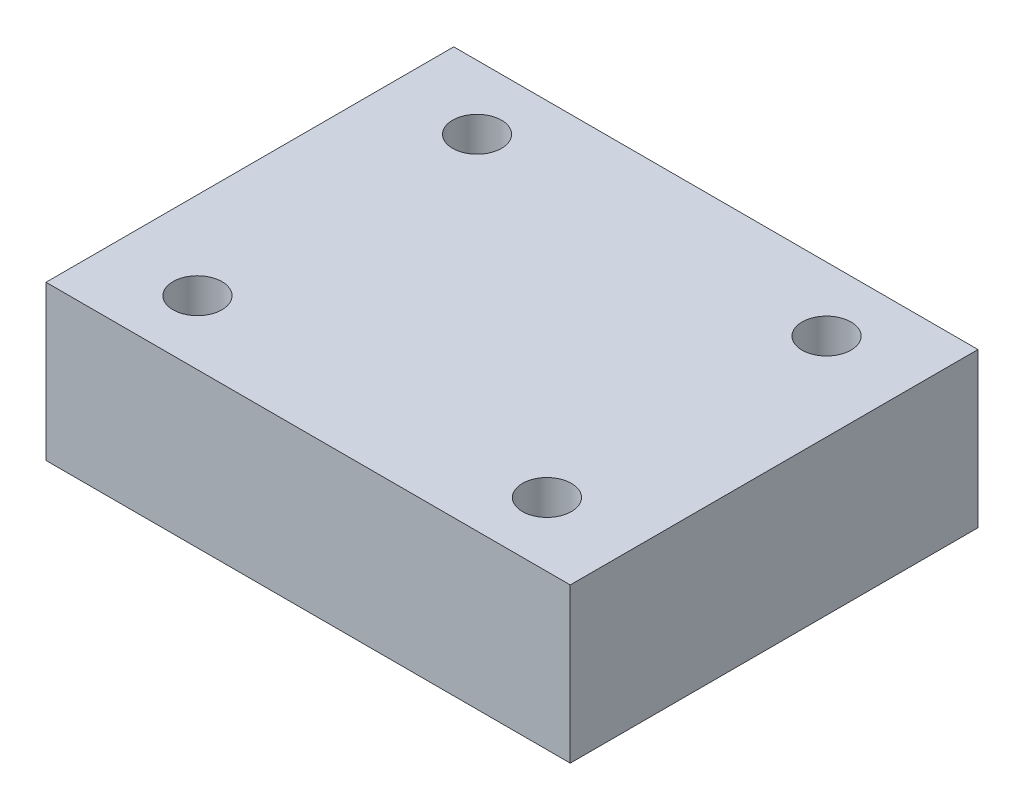
from build123d import *

# Parameters (mm, degrees)
SKETCH_1_W      = 45
SKETCH_1_H      = 35
SKETCH_1_R      = 2.1
EXTRUDE_1_DEPTH = 13.25


with BuildPart() as part:
    # 草图1 → 凸台-拉伸1 (new body)
    with BuildSketch(Plane(origin=(0, 0, 0), x_dir=(1, 0, 0), z_dir=(0, 1, 0))):
        Rectangle(SKETCH_1_W, SKETCH_1_H)
        with Locations(Location((-15, 12, 0), (0, 0, 270))):
            Circle(SKETCH_1_R, mode=Mode.SUBTRACT)
        with Locations(Location((15, 12, 0), (0, 0, 270))):
            Circle(SKETCH_1_R, mode=Mode.SUBTRACT)
        with Locations(Location((15, -12, 0), (0, 0, 270))):
            Circle(SKETCH_1_R, mode=Mode.SUBTRACT)
        with Locations(Location((-15, -12, 0), (0, 0, 270))):
            Circle(SKETCH_1_R, mode=Mode.SUBTRACT)
    extrude(amount=EXTRUDE_1_DEPTH)


solid = part.part
